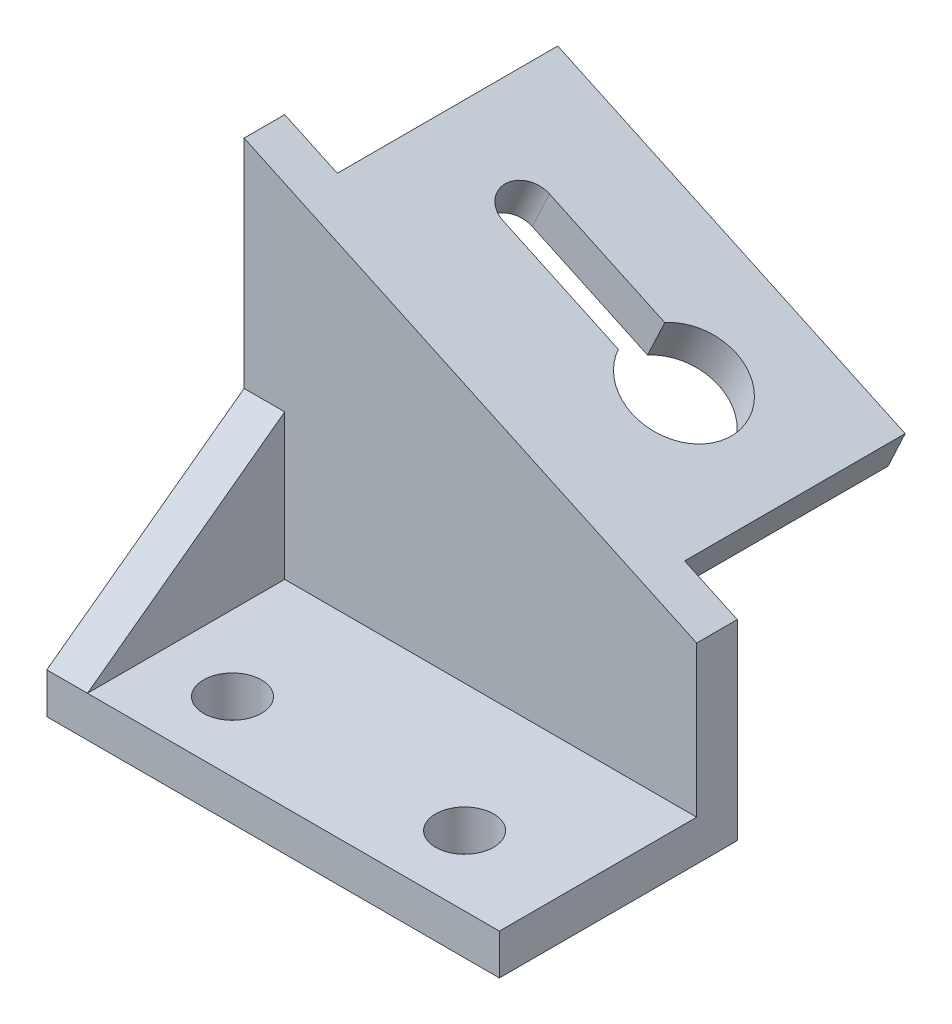
from build123d import *

# Parameters (mm, degrees)
SZKIC1_W                    = 78
SZKIC1_H                    = 41
DODANIE_WYCI_GNI_CIE1_DEPTH = 7
DODANIE_WYCI_GNI_CIE2_DEPTH = 7
DODANIE_WYCI_GNI_CIE3_DEPTH = 7
SZKIC5_R                    = 5
WYTNIJ_WYCI_GNI_CIE1_DEPTH  = 7
DODANIE_WYCI_GNI_CIE4_DEPTH = 38
WYTNIJ_WYCI_GNI_CIE2_DEPTH  = 38


with BuildPart() as part:
    # Szkic1 → Dodanie-wyciągnięcie1 (new body)
    with BuildSketch(Plane(origin=(0, 0, 0), x_dir=(1, 0, 0), z_dir=(0, 1, 0))):
        with Locations((39, 20.5)):
            Rectangle(SZKIC1_W, SZKIC1_H)
    extrude(amount=DODANIE_WYCI_GNI_CIE1_DEPTH)

    # Szkic3 → Dodanie-wyciągnięcie2 (add)
    with BuildSketch(Plane(origin=(0, 0, -41), x_dir=(-1, 0, 0), z_dir=(0, 0, -1))):
        Polygon((-78, 7), (-78, 33), (0, 69.371997336), (0, 7), align=None)
    extrude(amount=-DODANIE_WYCI_GNI_CIE2_DEPTH)

    # Szkic4 → Dodanie-wyciągnięcie3 (add)
    with BuildSketch(Plane.ZY):
        Polygon((-34, 7), (-34, 32), (0, 7), align=None)
    extrude(amount=-DODANIE_WYCI_GNI_CIE3_DEPTH)

    # Szkic5 → Wytnij-wyciągnięcie1 (cut)
    with BuildSketch(Plane(origin=(0, 7, 0), x_dir=(1, 0, 0), z_dir=(0, 1, 0))):
        with Locations(Location((20, 12, 0), (0, 0, 270))):
            Circle(SZKIC5_R)
        with Locations(Location((60, 12, 0), (0, 0, 270))):
            Circle(SZKIC5_R)
    extrude(amount=-WYTNIJ_WYCI_GNI_CIE1_DEPTH, mode=Mode.SUBTRACT)

    # Szkic6 → Dodanie-wyciągnięcie4 (add)
    with BuildSketch(Plane(origin=(0, 0, -41), x_dir=(-1, 0, 0), z_dir=(0, 0, -1))):
        Polygon((-68.93692213, 37.226182617), (-65.978594297, 30.882028108), (-6.104750038, 58.801660209), (-9.06307787, 65.145814719), align=None)
    extrude(amount=DODANIE_WYCI_GNI_CIE4_DEPTH)

    # Szkic7 → Wytnij-wyciągnięcie2 (cut)
    with BuildSketch(Plane(origin=(26.571016534, 56.981728841, 0), x_dir=(0.9063077870366525, -0.42261826174069395, 0), z_dir=(0.42261826174069395, 0.9063077870366525, 0))):
        with BuildLine():
            Line((-3.254395249, 63), (18.683347003, 63))
            ThreePointArc((18.683347003, 63), (35.745604751, 59), (18.683347003, 55))
            Line((18.683347003, 55), (-3.254395249, 55))
            ThreePointArc((-3.254395249, 55), (-7.254395249, 59), (-3.254395249, 63))
        make_face()
    extrude(amount=-WYTNIJ_WYCI_GNI_CIE2_DEPTH, mode=Mode.SUBTRACT)


solid = part.part
